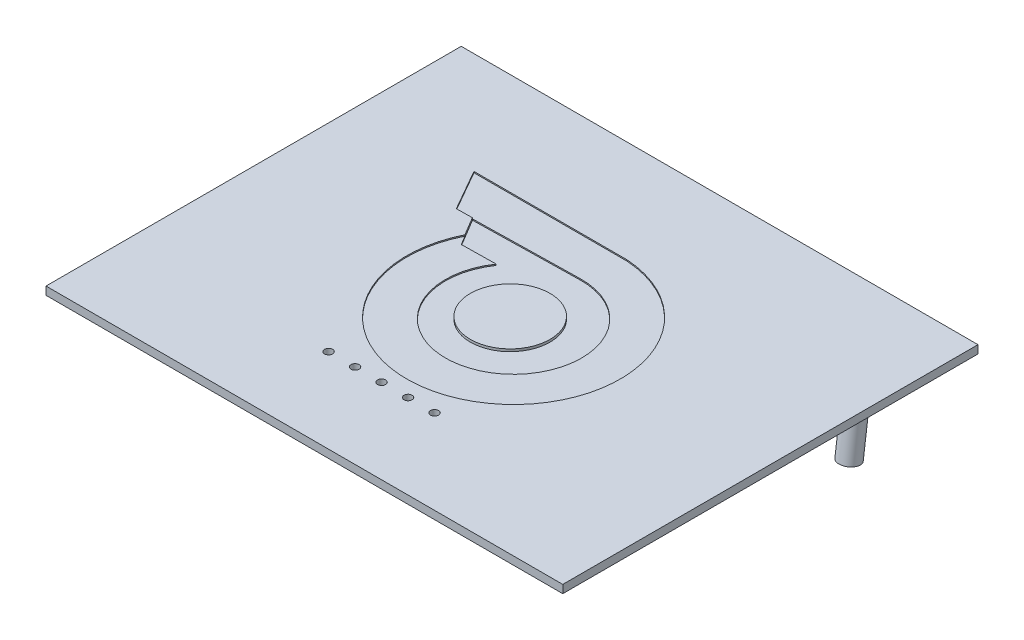
from build123d import *

# Parameters (mm, degrees)
SKETCH1_W                      = 128
SKETCH1_H                      = 101
BOSS_EXTRUDE1_DEPTH            = 2
SKETCH2_W                      = 1.2
SKETCH2_H                      = 98
BOSS_EXTRUDE2_DEPTH            = 1
SKETCH3_W                      = 128
SKETCH3_H                      = 2
BOSS_EXTRUDE3_DEPTH            = 0.48
SKETCH4_W                      = 128
SKETCH4_H                      = 2
BOSS_EXTRUDE4_DEPTH            = 1.37
BOSS_EXTRUDE5_START            = 2
SKETCH5_R                      = 2.5
BOSS_EXTRUDE5_DEPTH            = 13
M3_CLEARANCE_HOLE1_D           = 2.6
M3_CLEARANCE_HOLE1_DEPTH       = 10
M3_CLEARANCE_HOLE1_CSINK_D     = 3
M3_CLEARANCE_HOLE1_CSINK_ANGLE = 90
M3_CLEARANCE_HOLE1_TIP         = 0.781118805
M3_CLEARANCE_HOLE2_D           = 2.6
M3_CLEARANCE_HOLE2_DEPTH       = 10
M3_CLEARANCE_HOLE2_CSINK_D     = 3
M3_CLEARANCE_HOLE2_CSINK_ANGLE = 90
M3_CLEARANCE_HOLE2_TIP         = 0.781118805
SKETCH14_R                     = 1
CUT_EXTRUDE1_DEPTH             = 5
CUT_EXTRUDE2_DEPTH             = 0.4
CUT_EXTRUDE4_DEPTH             = 0.3
CUT_EXTRUDE5_DEPTH             = 0.6
SKETCH30_R                     = 9.871633986
BOSS_EXTRUDE13_DEPTH           = 0.6


with BuildPart() as part:
    # Sketch1 → Boss-Extrude1 (new body)
    with BuildSketch(Plane(origin=(0, 0, 0), x_dir=(1, 0, 0), z_dir=(0, 1, 0))):
        Rectangle(SKETCH1_W, SKETCH1_H)
    extrude(amount=BOSS_EXTRUDE1_DEPTH)

    # Sketch2 → Boss-Extrude2 (add)
    with BuildSketch(Plane.XZ):
        with Locations((62.3, 0)):
            Rectangle(SKETCH2_W, SKETCH2_H)
        with Locations((-62.3, 0)):
            Rectangle(SKETCH2_W, SKETCH2_H)
    extrude(amount=BOSS_EXTRUDE2_DEPTH)

    # Sketch3 → Boss-Extrude3 (add)
    with BuildSketch(Plane.XY.offset(50.5)):
        with Locations((0, 1)):
            Rectangle(SKETCH3_W, SKETCH3_H)
    extrude(amount=BOSS_EXTRUDE3_DEPTH)

    # Sketch4 → Boss-Extrude4 (add)
    with BuildSketch(Plane(origin=(0, 0, -50.5), x_dir=(-1, 0, 0), z_dir=(0, 0, -1))):
        with Locations((0, 1)):
            Rectangle(SKETCH4_W, SKETCH4_H)
    extrude(amount=BOSS_EXTRUDE4_DEPTH)

    # Sketch5 → Boss-Extrude5 (add)
    with BuildSketch(Plane(origin=(0, -10.49000593, 1.363700771), x_dir=(1, 0, 0), z_dir=(0, 0.9916556173432378, -0.12891523025462098)).offset(BOSS_EXTRUDE5_START)):
        with Locations(Location((-59.478852689, 26.433660117, 0), (0, 0, 152.68023031))):
            Circle(SKETCH5_R)
        with Locations(Location((58.821147316, 26.433660117, 0), (0, 0, 270))):
            Circle(SKETCH5_R)
    extrude(amount=BOSS_EXTRUDE5_DEPTH)

    # M3 Clearance Hole1
    with Locations(Plane(origin=(0, -8.506694695, 1.10587031), x_dir=(1, 0, 0), z_dir=(0, -0.9916556173432378, 0.12891523025462098))):
        with Locations((58.821147316, -26.433660117)):
            CounterSinkHole(M3_CLEARANCE_HOLE1_D / 2, M3_CLEARANCE_HOLE1_CSINK_D / 2, depth=M3_CLEARANCE_HOLE1_DEPTH, counter_sink_angle=M3_CLEARANCE_HOLE1_CSINK_ANGLE)
            with Locations((0, 0, -(M3_CLEARANCE_HOLE1_DEPTH + M3_CLEARANCE_HOLE1_TIP / 2))):  # 118° drill point
                Cone(0, M3_CLEARANCE_HOLE1_D / 2, M3_CLEARANCE_HOLE1_TIP, mode=Mode.SUBTRACT)

    # M3 Clearance Hole2
    with Locations(Plane(origin=(0, -8.506694695, 1.10587031), x_dir=(1, 0, 0), z_dir=(0, -0.9916556173432378, 0.12891523025462098))):
        with Locations((-59.478852689, -26.433660117)):
            CounterSinkHole(M3_CLEARANCE_HOLE2_D / 2, M3_CLEARANCE_HOLE2_CSINK_D / 2, depth=M3_CLEARANCE_HOLE2_DEPTH, counter_sink_angle=M3_CLEARANCE_HOLE2_CSINK_ANGLE)
            with Locations((0, 0, -(M3_CLEARANCE_HOLE2_DEPTH + M3_CLEARANCE_HOLE2_TIP / 2))):  # 118° drill point
                Cone(0, M3_CLEARANCE_HOLE2_D / 2, M3_CLEARANCE_HOLE2_TIP, mode=Mode.SUBTRACT)

    # Sketch14 → Cut-Extrude1 (cut)
    with BuildSketch(Plane.XZ):
        with Locations(Location((-8.372305841, 30.05428165, 0), (0, 0, 270))):
            Circle(SKETCH14_R)
        with Locations(Location((4.754600466, 30.05428165, 0), (0, 0, 270))):
            Circle(SKETCH14_R)
        with Locations(Location((11.318053619, 30.05428165, 0), (0, 0, 270))):
            Circle(SKETCH14_R)
        with Locations(Location((-14.935758995, 30.05428165, 0), (0, 0, 270))):
            Circle(SKETCH14_R)
        with Locations(Location((-1.808852688, 30.05428165, 0), (0, 0, 270))):
            Circle(SKETCH14_R)
    extrude(amount=-CUT_EXTRUDE1_DEPTH, mode=Mode.SUBTRACT)

    # Sketch15 → Cut-Extrude2 (cut)
    with BuildSketch(Plane.XZ):
        Polygon((-16.43147406, 32.05428165), (14.761074601, 32.05428165), (19.761074601, 32.05428165), (19.761074601, 28.05428165), (14.761074601, 28.05428165), (-16.43147406, 28.05428165), (-21.43147406, 28.05428165), (-21.43147406, 32.05428165), align=None)
    extrude(amount=-CUT_EXTRUDE2_DEPTH, mode=Mode.SUBTRACT)

    # Sketch31 → Cut-Extrude4 (cut)
    with BuildSketch(Plane(origin=(0, 2, 0), x_dir=(1, 0, 0), z_dir=(0, 1, 0))):
        with BuildLine():
            Line((-35.589637389, 26.611090632), (2.358171766, 26.611090632))
            ThreePointArc((2.358171766, 26.611090632), (11.389438086, -23.958753128), (-20.168517513, 16.574792334))
            Line((-20.168517513, 16.574792334), (-29.764841633, 16.423494794))
            Line((-29.764841633, 16.423494794), (-35.589637389, 26.611090632))
        make_face()
    extrude(amount=-CUT_EXTRUDE4_DEPTH, mode=Mode.SUBTRACT)

    # Sketch29 → Cut-Extrude5 (cut)
    with BuildSketch(Plane(origin=(0, 2, 0), x_dir=(1, 0, 0), z_dir=(0, 1, 0))):
        with BuildLine():
            Line((-25.889090528, 16.549174918), (0.216418019, 17.068757453))
            ThreePointArc((0.216418019, 17.068757453), (8.636281726, -14.628247298), (-13.255238872, 9.79214461))
            Line((-13.255238872, 9.79214461), (-21.775344713, 9.65781494))
            Line((-21.775344713, 9.65781494), (-25.889090528, 16.549174918))
        make_face()
    extrude(amount=-CUT_EXTRUDE5_DEPTH, mode=Mode.SUBTRACT)


with BuildPart() as body_2:
    # Sketch30 → Boss-Extrude13 (new body)
    with BuildSketch(Plane(origin=(0, 2, 0), x_dir=(1, 0, 0), z_dir=(0, 1, 0))):
        with Locations(Location((0, 0, 0), (0, 0, 270))):
            Circle(SKETCH30_R)
    extrude(amount=-BOSS_EXTRUDE13_DEPTH)


solid = Compound([part.part, body_2.part])
